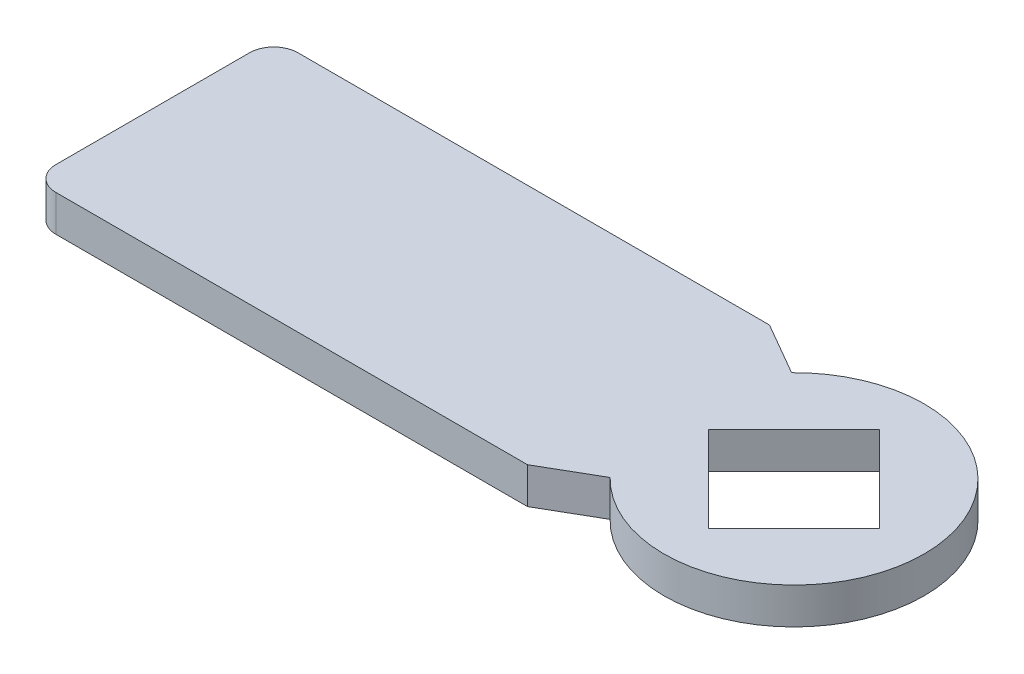
from build123d import *

# Parameters (mm, degrees)
EXTRUDE_1_DEPTH     = 3
FILLET_1_R          = 2
CUT_EXTRUDE_1_DEPTH = 55.162371625


with BuildPart() as part:
    # 草图2 → 凸台-拉伸1 (new body)
    with BuildSketch(Plane(origin=(0, 0, 0), x_dir=(1, 0, 0), z_dir=(0, 1, 0))):
        with BuildLine():
            Line((-12.031587919, -10), (-7.7014609, -7.5))
            ThreePointArc((-7.7014609, -7.5), (10.75, 0), (-7.7014609, 7.5))
            Line((-7.7014609, 7.5), (-12.031587919, 10))
            Line((-12.031587919, 10), (-53, 10))
            Line((-53, 10), (-53, -10))
            Line((-53, -10), (-12.031587919, -10))
        make_face()
    extrude(amount=EXTRUDE_1_DEPTH)

    # 圆角1
    fillet_1_edges = [part.edges().sort_by_distance(p)[0] for p in [
        (-53, 1.5, -10),
        (-53, 1.5, 10),
    ]]
    fillet(fillet_1_edges, radius=FILLET_1_R)

    # 草图3 → 切除-拉伸1 (cut, through all)
    with BuildSketch(Plane(origin=(0, 3, 0), x_dir=(1, 0, 0), z_dir=(0, 1, 0))):
        Polygon((0, 7.071067812), (-7.071067812, 0), (0, -7.071067812), (7.071067812, 0), align=None)
    extrude(amount=-CUT_EXTRUDE_1_DEPTH, mode=Mode.SUBTRACT)


solid = part.part
